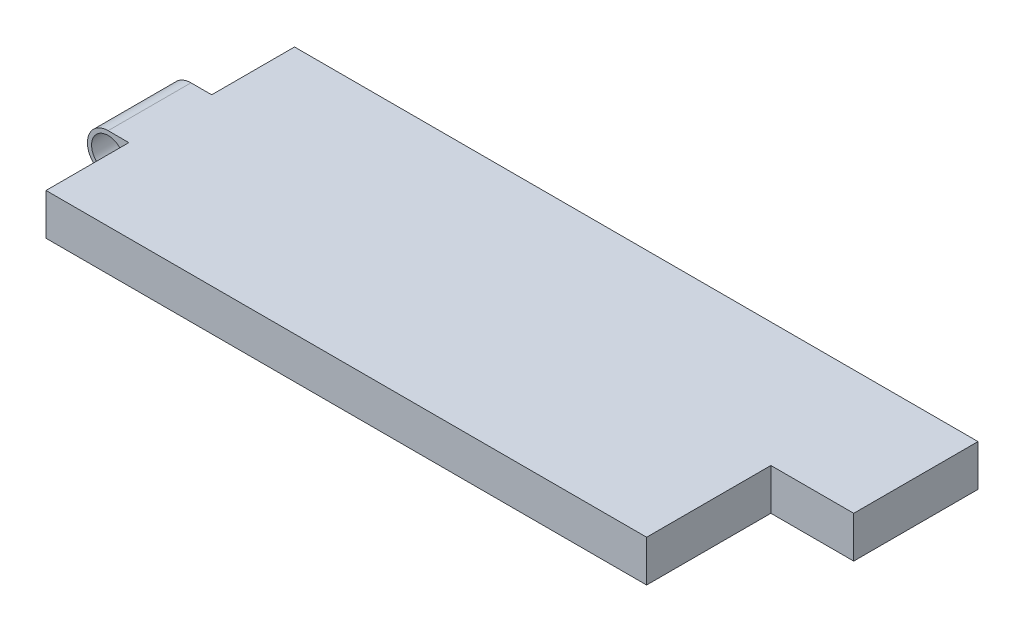
from build123d import *

# Parameters (mm, degrees)
BASE_DEPTH              = 5
BASE_DEPTH_BACK         = 5
ESQUISSE1_R             = 2
ESQUISSE2_W             = 77.5
ESQUISSE2_H             = 5
BOSS_EXTRU_2_DEPTH      = 10
ESQUISSE3_W             = 77.5
ESQUISSE3_H             = 5
BOSS_EXTRU_3_DEPTH      = 10
ESQUISSE4_W             = 5
ESQUISSE4_H             = 15
BOSS_EXTRU_4_DEPTH      = 5
ESQUISSE5_W             = 5
ESQUISSE5_H             = 15
ENL_V_MAT_EXTRU_1_DEPTH = 5


with BuildPart() as part:
    # Esquisse1 → BASE (new, two sides: drawn at the far end of the back side and taken through both)
    with BuildSketch(Plane.XY.offset(-BASE_DEPTH_BACK)):
        with BuildLine():
            Line((-80, 2.5), (0, 2.5))
            Line((0, 2.5), (0, -2.5))
            Line((0, -2.5), (-80, -2.5))
            ThreePointArc((-80, -2.5), (-82.5, 0), (-80, 2.5))
        make_face()
        with Locations((-80, 0)):
            Circle(ESQUISSE1_R, mode=Mode.SUBTRACT)
    extrude(amount=BASE_DEPTH + BASE_DEPTH_BACK)

    # Esquisse2 → Boss.-Extru.2 (add)
    with BuildSketch(Plane.XY.offset(5)):
        with Locations((-38.75, 0)):
            Rectangle(ESQUISSE2_W, ESQUISSE2_H)
    extrude(amount=BOSS_EXTRU_2_DEPTH)

    # Esquisse3 → Boss.-Extru.3 (add)
    with BuildSketch(Plane(origin=(0, 0, -5), x_dir=(-1, 0, 0), z_dir=(0, 0, -1))):
        with Locations((38.75, 0)):
            Rectangle(ESQUISSE3_W, ESQUISSE3_H)
    extrude(amount=BOSS_EXTRU_3_DEPTH)

    # Esquisse4 → Boss.-Extru.4 (add)
    with BuildSketch(Plane(origin=(0, 2.5, 0), x_dir=(1, 0, 0), z_dir=(0, 1, 0))):
        with Locations((2.5, 7.5)):
            Rectangle(ESQUISSE4_W, ESQUISSE4_H)
    extrude(amount=-BOSS_EXTRU_4_DEPTH)

    # Esquisse5 → Enlèv. mat.-Extru.1 (cut)
    with BuildSketch(Plane(origin=(0, 2.5, 0), x_dir=(1, 0, 0), z_dir=(0, 1, 0))):
        with Locations((-2.5, -7.5)):
            Rectangle(ESQUISSE5_W, ESQUISSE5_H)
    extrude(amount=-ENL_V_MAT_EXTRU_1_DEPTH, mode=Mode.SUBTRACT)


solid = part.part
